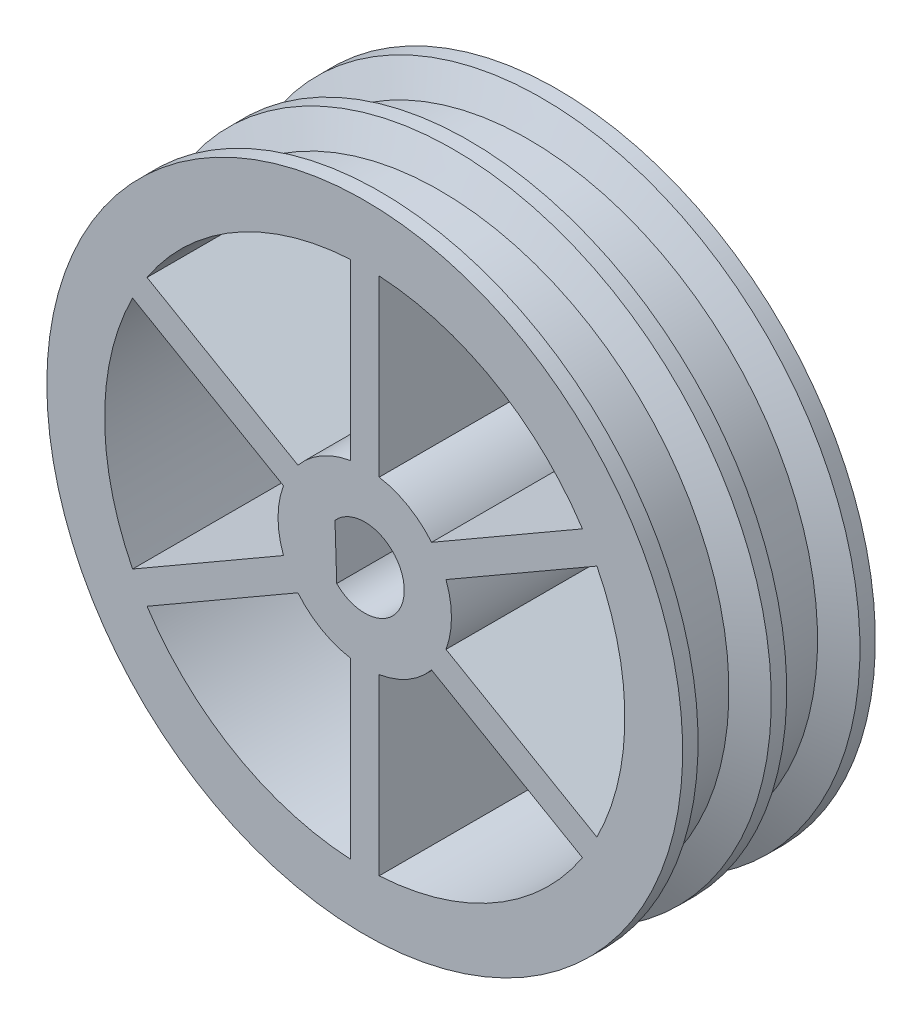
from build123d import *

# Parameters (mm, degrees)
SKETCH_1_R      = 30
EXTRUDE_1_DEPTH = 20


with BuildPart() as part:
    # 草图1 → 凸台-拉伸1 (new body)
    with BuildSketch(Plane.XY):
        Circle(SKETCH_1_R)
        with BuildLine():
            Line((-3.088645972, 2.69634309), (-2.908227328, -2.89001969))
            ThreePointArc((-2.908227328, -2.89001969), (4.097863422, 0.132345676), (-3.088645972, 2.69634309))
        make_face(mode=Mode.SUBTRACT)
        with BuildLine():
            Line((22.596573624, 14.778188672), (6.935213074, 5.736097943))
            ThreePointArc((6.935213074, 5.736097943), (4.5, 7.794228634), (1.5, 8.874119675))
            Line((1.5, 8.874119675), (1.5, 26.958301133))
            ThreePointArc((1.5, 26.958301133), (13.5, 23.382685902), (22.596573624, 14.778188672))
        make_face(mode=Mode.SUBTRACT)
        with BuildLine():
            Line((-1.5, 26.958301133), (-1.5, 8.874119675))
            ThreePointArc((-1.5, 8.874119675), (-4.5, 7.794228634), (-6.935213074, 5.736097943))
            Line((-6.935213074, 5.736097943), (-22.596573624, 14.778188672))
            ThreePointArc((-22.596573624, 14.778188672), (-13.5, 23.382685902), (-1.5, 26.958301133))
        make_face(mode=Mode.SUBTRACT)
        with BuildLine():
            Line((24.096573624, 12.180112461), (8.435213074, 3.138021732))
            ThreePointArc((8.435213074, 3.138021732), (9, 0), (8.435213074, -3.138021732))
            Line((8.435213074, -3.138021732), (24.096573624, -12.180112461))
            ThreePointArc((24.096573624, -12.180112461), (27, 0), (24.096573624, 12.180112461))
        make_face(mode=Mode.SUBTRACT)
        with BuildLine():
            Line((22.596573624, -14.778188672), (6.935213074, -5.736097943))
            ThreePointArc((6.935213074, -5.736097943), (4.5, -7.794228634), (1.5, -8.874119675))
            Line((1.5, -8.874119675), (1.5, -26.958301133))
            ThreePointArc((1.5, -26.958301133), (13.5, -23.382685902), (22.596573624, -14.778188672))
        make_face(mode=Mode.SUBTRACT)
        with BuildLine():
            Line((-1.5, -26.958301133), (-1.5, -8.874119675))
            ThreePointArc((-1.5, -8.874119675), (-4.5, -7.794228634), (-6.935213074, -5.736097943))
            Line((-6.935213074, -5.736097943), (-22.596573624, -14.778188672))
            ThreePointArc((-22.596573624, -14.778188672), (-13.5, -23.382685902), (-1.5, -26.958301133))
        make_face(mode=Mode.SUBTRACT)
        with BuildLine():
            Line((-24.096573624, -12.180112461), (-8.435213074, -3.138021732))
            ThreePointArc((-8.435213074, -3.138021732), (-9, 0), (-8.435213074, 3.138021732))
            Line((-8.435213074, 3.138021732), (-24.096573624, 12.180112461))
            ThreePointArc((-24.096573624, 12.180112461), (-27, 0), (-24.096573624, -12.180112461))
        make_face(mode=Mode.SUBTRACT)
    extrude(amount=EXTRUDE_1_DEPTH)

    # 草图2 → 旋转1 (revolve)
    with BuildSketch(Plane.ZY, mode=Mode.PRIVATE) as revolve_1_sk:
        Polygon((0, -30), (0, -33), (1.6, -33), (3, -30), align=None)
        Polygon((17, -30), (20, -30), (20, -33), (18.4, -33), align=None)
        Polygon((7.8, -30), (9.2, -33), (10.8, -33), (12.2, -30), align=None)
    revolve(revolve_1_sk.sketch.rotate(Axis((0, 0, 0), (0, 0, 1)), 270), axis=Axis((0, 0, 0), (0, 0, 1)))


solid = part.part
